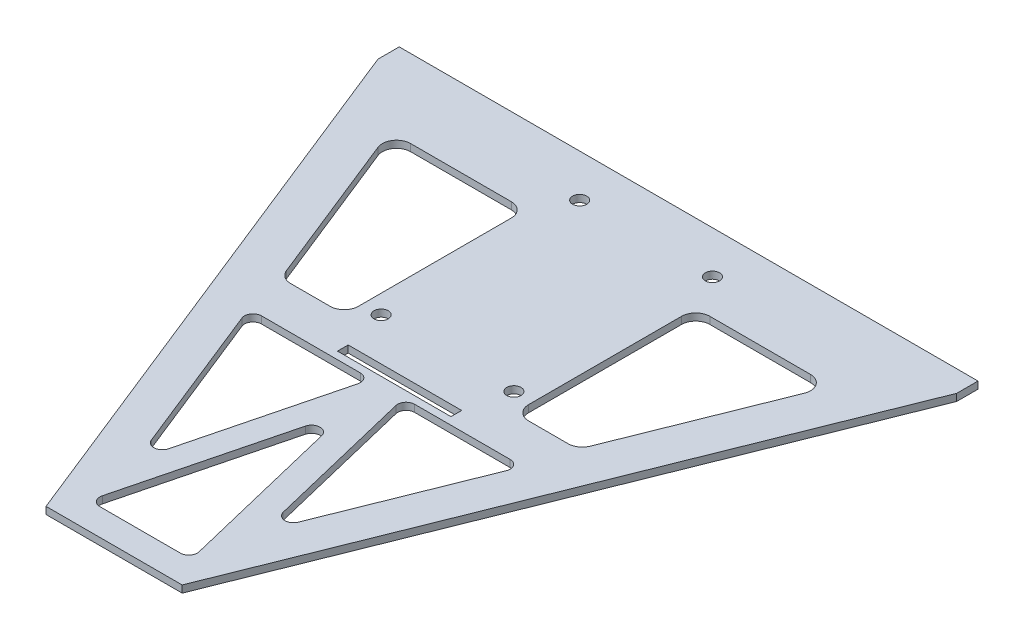
from build123d import *

# Parameters (mm, degrees)
BOSS_EXTRUDE1_DEPTH = 3.175
FILLET1_R           = 3.81
CUT_EXTRUDE1_DEPTH  = 3.175
FILLET2_R           = 6.35
SKETCH5_W           = 259.08
SKETCH5_H           = 3.175
BOSS_EXTRUDE2_DEPTH = 4.7625
CUT_EXTRUDE2_REACH  = 360.417
SKETCH6_W           = 50.8
SKETCH6_H           = 4.7879
SKETCH9_W           = 259.08
SKETCH9_H           = 3.175
BOSS_EXTRUDE3_DEPTH = 4.7625
SKETCH10_R          = 3.175
CUT_EXTRUDE4_DEPTH  = 359.417423579


with BuildPart() as part:
    # Sketch2 → Boss-Extrude1 (new body)
    with BuildSketch(Plane(origin=(0, 0, 0), x_dir=(1, 0, 0), z_dir=(0, 1, 0))):
        Polygon((0, 0), (259.08, 0), (160.02, -247.65), (99.06, -247.65), align=None)
        Polygon((152.079282437, -235.710784307), (106.359282437, -235.710784307), (129.772405457, -143.63904611), align=None, mode=Mode.SUBTRACT)
        Polygon((101.296371264, -209.241791453), (122.57344543, -125.570031796), (67.827667402, -125.570031796), align=None, mode=Mode.SUBTRACT)
        Polygon((157.226545347, -208.413887274), (190.364087539, -125.570031796), (137.155373359, -125.570031796), align=None, mode=Mode.SUBTRACT)
    extrude(amount=BOSS_EXTRUDE1_DEPTH)

    # Fillet1
    fillet1_edges = [part.edges().sort_by_distance(p)[0] for p in [
        (152.079282437, 1.5875, 235.710784307),
        (129.772405457, 1.5875, 143.63904611),
        (106.359282437, 1.5875, 235.710784307),
        (67.827667402, 1.5875, 125.570031796),
        (101.296371264, 1.5875, 209.241791453),
        (122.57344543, 1.5875, 125.570031796),
        (137.155373359, 1.5875, 125.570031796),
        (157.226545347, 1.5875, 208.413887274),
        (190.364087539, 1.5875, 125.570031796),
    ]]
    fillet(fillet1_edges, radius=FILLET1_R)

    # Sketch3 → Cut-Extrude1 (cut)
    with BuildSketch(Plane(origin=(0, 3.175, 0), x_dir=(1, 0, 0), z_dir=(0, 1, 0))):
        Polygon((167.64, -25.4), (228.402522085, -25.4), (195.954509366, -106.520031796), (167.64, -106.520031796), align=None)
        Polygon((91.44, -106.520031796), (91.44, -25.4), (30.677477915, -25.4), (63.125490634, -106.520031796), align=None)
    extrude(amount=-CUT_EXTRUDE1_DEPTH, mode=Mode.SUBTRACT)

    # Fillet2
    fillet2_edges = [part.edges().sort_by_distance(p)[0] for p in [
        (195.954509366, 1.5875, 106.520031796),
        (228.402522085, 1.5875, 25.4),
        (167.64, 1.5875, 25.4),
        (167.64, 1.5875, 106.520031796),
        (91.44, 1.5875, 25.4),
        (30.677477915, 1.5875, 25.4),
        (63.125490634, 1.5875, 106.520031796),
        (91.44, 1.5875, 106.520031796),
    ]]
    fillet(fillet2_edges, radius=FILLET2_R)

    # Sketch5 → Boss-Extrude2 (add)
    with BuildSketch(Plane(origin=(0, 0, 0), x_dir=(-1, 0, 0), z_dir=(0, 0, -1))):
        with Locations((-129.54, 1.5875)):
            Rectangle(SKETCH5_W, SKETCH5_H)
    extrude(amount=BOSS_EXTRUDE2_DEPTH)

    # Sketch6 → Cut-Extrude2 (cut, up to next)
    with BuildSketch(Plane(origin=(0, 3.175, 0), x_dir=(1, 0, 0), z_dir=(0, 1, 0)), mode=Mode.PRIVATE) as cut_extrude2_sk1:
        with Locations((129.526089834, -119.84355)):
            Rectangle(SKETCH6_W, SKETCH6_H)
    cut_extrude2_tool1 = extrude(cut_extrude2_sk1.sketch, amount=-CUT_EXTRUDE2_REACH, mode=Mode.PRIVATE) & part.part
    add(cut_extrude2_tool1.solids().sort_by_distance((129.52609, 3.175, 119.84355))[0], mode=Mode.SUBTRACT)

    # Sketch9 → Boss-Extrude3 (add)
    with BuildSketch(Plane(origin=(0, 0, -4.7625), x_dir=(-1, 0, 0), z_dir=(0, 0, -1))):
        with Locations((-129.54, 1.5875)):
            Rectangle(SKETCH9_W, SKETCH9_H)
    extrude(amount=BOSS_EXTRUDE3_DEPTH)

    # Sketch10 → Cut-Extrude4 (cut, through all)
    with BuildSketch(Plane(origin=(0, 3.175, 0), x_dir=(1, 0, 0), z_dir=(0, 1, 0))):
        with Locations(Location((99.822, -98.3996, 0), (0, 0, 270))):
            Circle(SKETCH10_R)
        with Locations(Location((159.258, -98.3996, 0), (0, 0, 270))):
            Circle(SKETCH10_R)
        with Locations(Location((99.822, -9.525, 0), (0, 0, 270))):
            Circle(SKETCH10_R)
        with Locations(Location((159.258, -9.525, 0), (0, 0, 270))):
            Circle(SKETCH10_R)
    extrude(amount=-CUT_EXTRUDE4_DEPTH, mode=Mode.SUBTRACT)


solid = part.part
